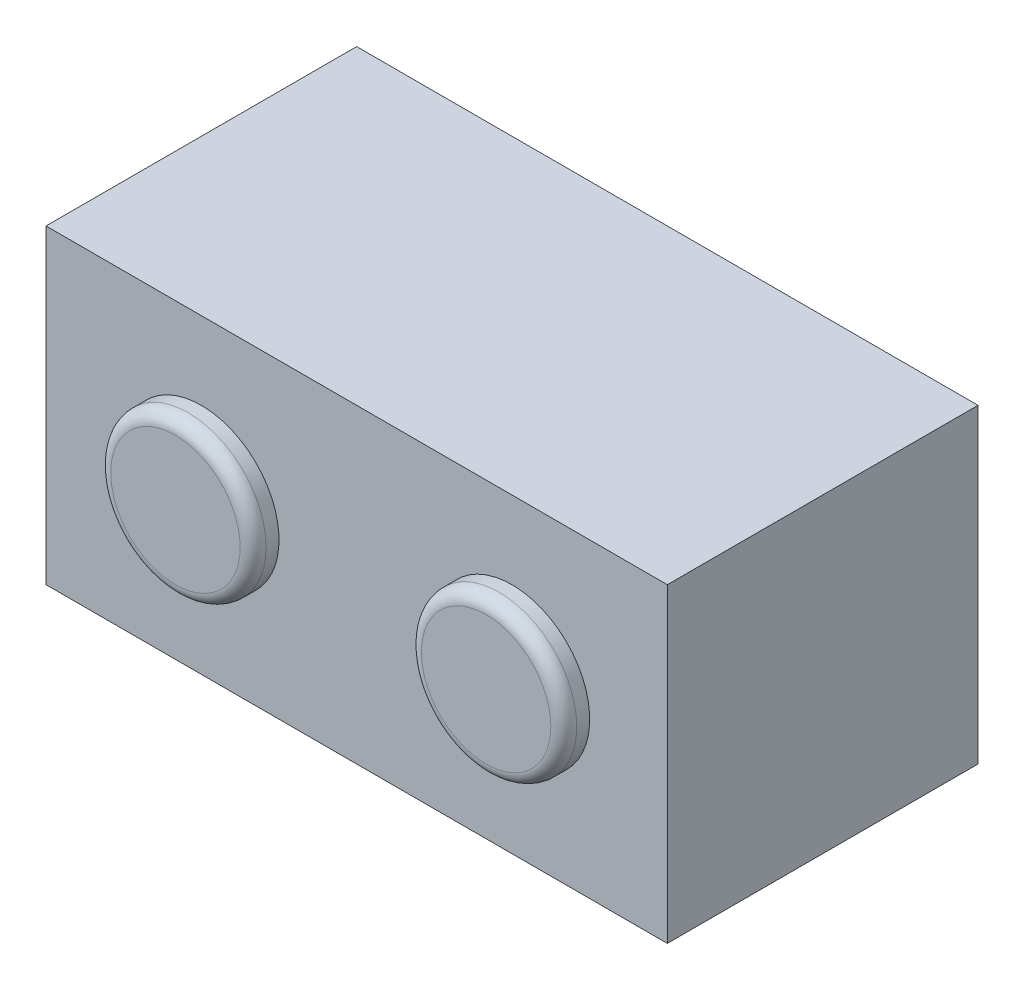
from build123d import *

# Parameters (mm, degrees)
SKETCH1_W           = 1219.2
SKETCH1_H           = 609.6
BOSS_EXTRUDE1_DEPTH = 609.6
SKETCH2_R           = 152.4
BOSS_EXTRUDE2_DEPTH = 50.8
FILLET1_R           = 25.4


with BuildPart() as part:
    # Sketch1 → Boss-Extrude1 (new body)
    with BuildSketch(Plane(origin=(0, 0, 0), x_dir=(1, 0, 0), z_dir=(0, 1, 0))):
        Rectangle(SKETCH1_W, SKETCH1_H)
    extrude(amount=BOSS_EXTRUDE1_DEPTH)

    # Sketch2 → Boss-Extrude2 (add)
    with BuildSketch(Plane.XY.offset(304.8)):
        with Locations(Location((-304.8, 304.8, 0), (0, 0, 180))):
            Circle(SKETCH2_R)
        with Locations(Location((304.8, 304.8, 0), (0, 0, 180))):
            Circle(SKETCH2_R)
    extrude(amount=BOSS_EXTRUDE2_DEPTH)

    # Fillet1
    fillet1_edges = [part.edges().sort_by_distance(p)[0] for p in [
        (-152.4, 304.8, 355.6),
        (457.2, 304.8, 355.6),
    ]]
    fillet(fillet1_edges, radius=FILLET1_R)


solid = part.part
